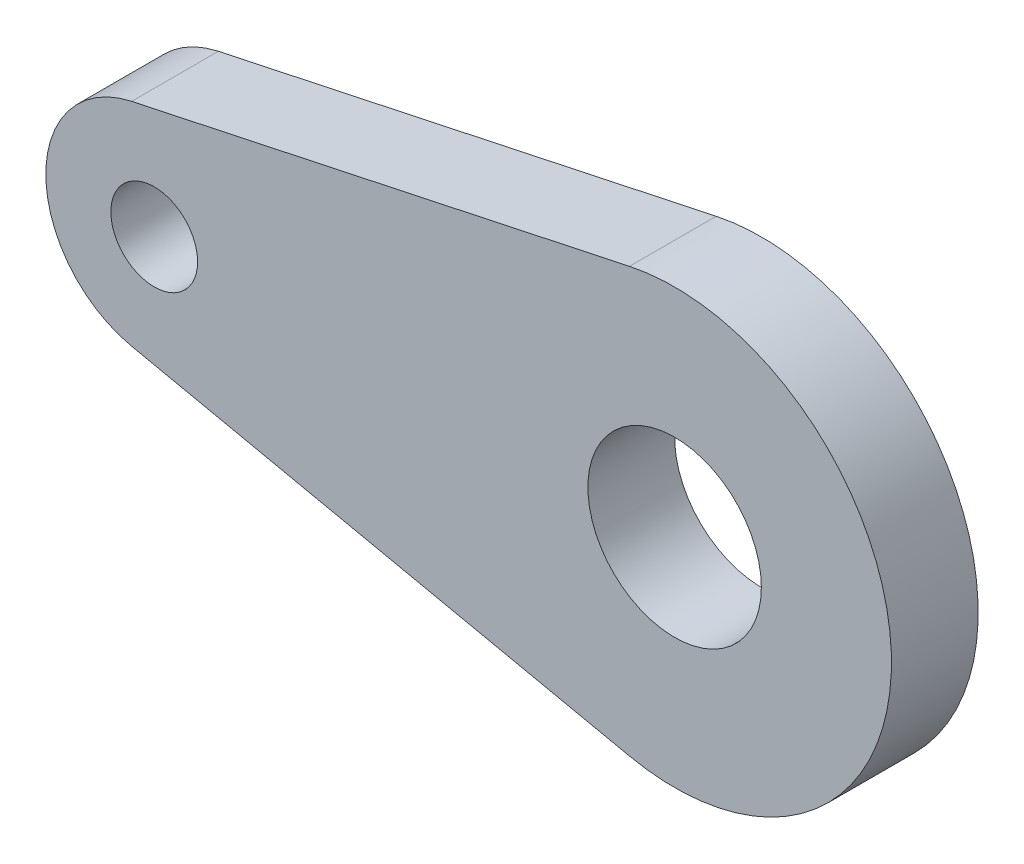
from build123d import *

# Parameters (mm, degrees)
SKETCH1_R           = 6.35
SKETCH1_R_2         = 12.7
BOSS_EXTRUDE1_DEPTH = 12.7


with BuildPart() as part:
    # Sketch1 → Boss-Extrude1 (new body)
    with BuildSketch(Plane.XY):
        with BuildLine():
            Line((-79.507291667, -15.52666889), (-6.614583333, -31.053337781))
            ThreePointArc((-6.614583333, -31.053337781), (31.75, 0), (-6.614583333, 31.053337781))
            Line((-6.614583333, 31.053337781), (-79.507291667, 15.52666889))
            ThreePointArc((-79.507291667, 15.52666889), (-92.075, 0), (-79.507291667, -15.52666889))
        make_face()
        with Locations((-76.2, 0)):
            Circle(SKETCH1_R, mode=Mode.SUBTRACT)
        Circle(SKETCH1_R_2, mode=Mode.SUBTRACT)
    extrude(amount=BOSS_EXTRUDE1_DEPTH)


solid = part.part
